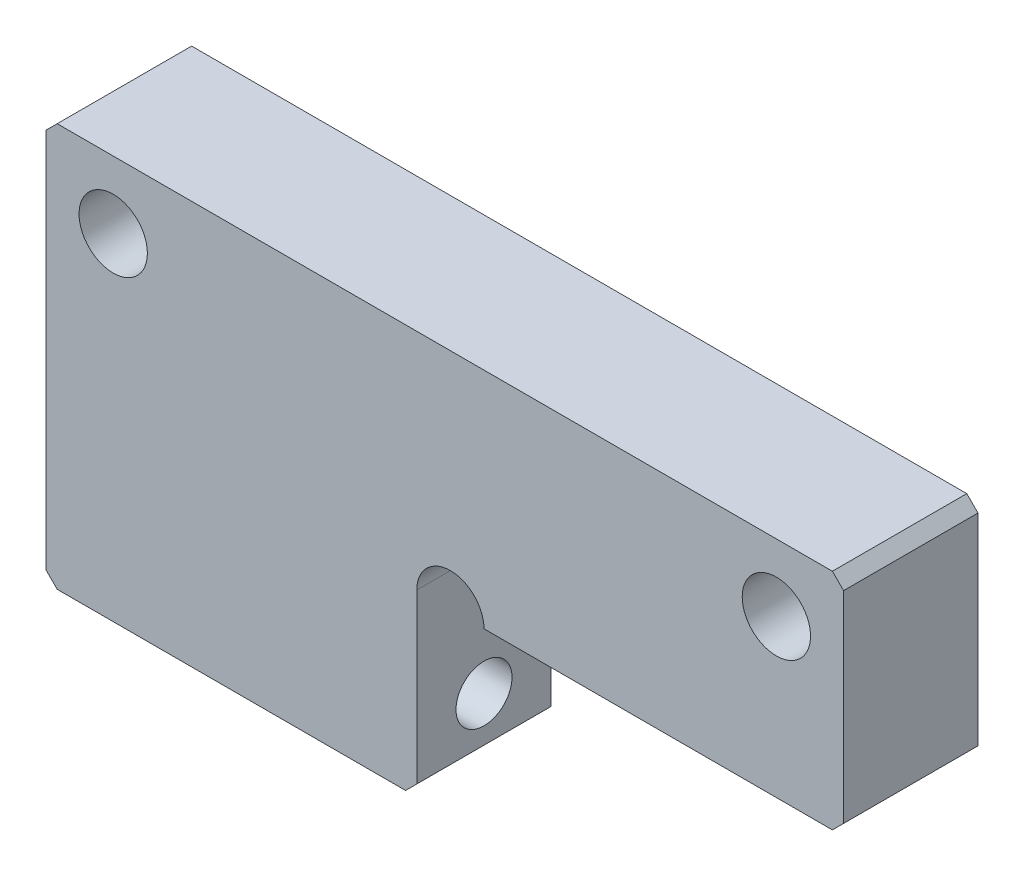
from build123d import *

# Parameters (mm, degrees)
SKETCH_1_W          = 35.6
SKETCH_1_H          = 18
EXTRUDE_1_DEPTH     = 6
SKETCH_3_W          = 2.5
SKETCH_3_H          = 16
CUT_EXTRUDE_1_DEPTH = 28
SKETCH_4_W          = 16.55
SKETCH_4_H          = 8
CUT_EXTRUDE_2_DEPTH = 10
HOLE_WIZARD_M3_1_D  = 2.5
SKETCH_8_R          = 1.525
CUT_EXTRUDE_3_DEPTH = 22
CHAMFER_1_SIZE      = 0.5
SKETCH_9_R          = 1.5
CUT_EXTRUDE_4_DEPTH = 10


with BuildPart() as part:
    # 草图1 → 凸台-拉伸1 (new body)
    with BuildSketch(Plane.XY):
        Rectangle(SKETCH_1_W, SKETCH_1_H)
    extrude(amount=EXTRUDE_1_DEPTH)

    # 草图3 → 切除-拉伸1 (cut)
    with BuildSketch(Plane(origin=(0, 0, 0), x_dir=(-1, 0, 0), z_dir=(0, 0, -1))):
        with Locations((0, -9)):
            Rectangle(SKETCH_3_W, SKETCH_3_H)
    extrude(amount=-CUT_EXTRUDE_1_DEPTH, mode=Mode.SUBTRACT)

    # 草图4 → 切除-拉伸2 (cut)
    with BuildSketch(Plane(origin=(0, 0, 0), x_dir=(-1, 0, 0), z_dir=(0, 0, -1))):
        with Locations((-9.525, -5)):
            Rectangle(SKETCH_4_W, SKETCH_4_H)
    extrude(amount=-CUT_EXTRUDE_2_DEPTH, mode=Mode.SUBTRACT)

    # M3 螺纹孔1 (through all)
    with Locations(Plane(origin=(-1.25, 0, 0), x_dir=(0, 0, -1), z_dir=(1, 0, 0))):
        with Locations((-3, -6.5)):
            Hole(HOLE_WIZARD_M3_1_D / 2)

    # 草图8 → 切除-拉伸3 (cut)
    with BuildSketch(Plane.XY.offset(6)):
        with Locations((-14.8, 6)):
            Circle(SKETCH_8_R)
        with Locations(Location((14.8, 6, 0), (0, 0, 180))):
            Circle(SKETCH_8_R)
    extrude(amount=-CUT_EXTRUDE_3_DEPTH, mode=Mode.SUBTRACT)

    # 倒角1
    chamfer_1_edges = [part.edges().sort_by_distance(p)[0] for p in [
        (-1.25, -9, 3),
        (17.8, -1, 3),
        (-17.8, -9, 3),
        (-17.8, 9, 3),
        (17.8, 9, 3),
    ]]
    chamfer(chamfer_1_edges, length=CHAMFER_1_SIZE)

    # 草图9 → 切除-拉伸4 (cut)
    with BuildSketch(Plane.XY.offset(6)):
        with Locations((0.25, -1)):
            Circle(SKETCH_9_R)
    extrude(amount=-CUT_EXTRUDE_4_DEPTH, mode=Mode.SUBTRACT)


solid = part.part
